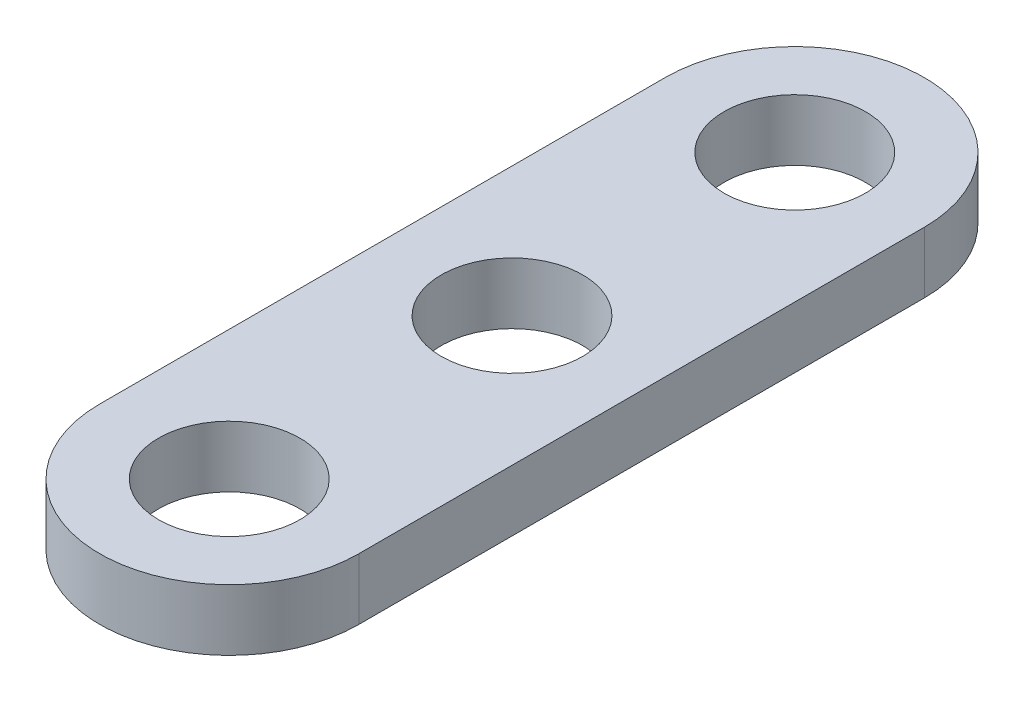
from build123d import *

# Parameters (mm, degrees)
SKETCH1_R           = 3
BOSS_EXTRUDE1_DEPTH = 2.6


with BuildPart() as part:
    # Sketch1 → Boss-Extrude1 (new body)
    with BuildSketch(Plane(origin=(0, 0, 0), x_dir=(1, 0, 0), z_dir=(0, 1, 0))):
        with BuildLine():
            Line((5.5, 6.087745386), (5.5, -17.912254614))
            ThreePointArc((5.5, -17.912254614), (0, -23.412254614), (-5.5, -17.912254614))
            Line((-5.5, -17.912254614), (-5.5, 6.087745386))
            ThreePointArc((-5.5, 6.087745386), (0, 11.587745386), (5.5, 6.087745386))
        make_face()
        with Locations(Location((0, 6.087745386, 0), (0, 0, 270))):
            Circle(SKETCH1_R, mode=Mode.SUBTRACT)
        with Locations(Location((0, -17.912254614, 0), (0, 0, 270))):
            Circle(SKETCH1_R, mode=Mode.SUBTRACT)
        with Locations(Location((0, -5.912254614, 0), (0, 0, 270))):
            Circle(SKETCH1_R, mode=Mode.SUBTRACT)
    extrude(amount=BOSS_EXTRUDE1_DEPTH)


solid = part.part
